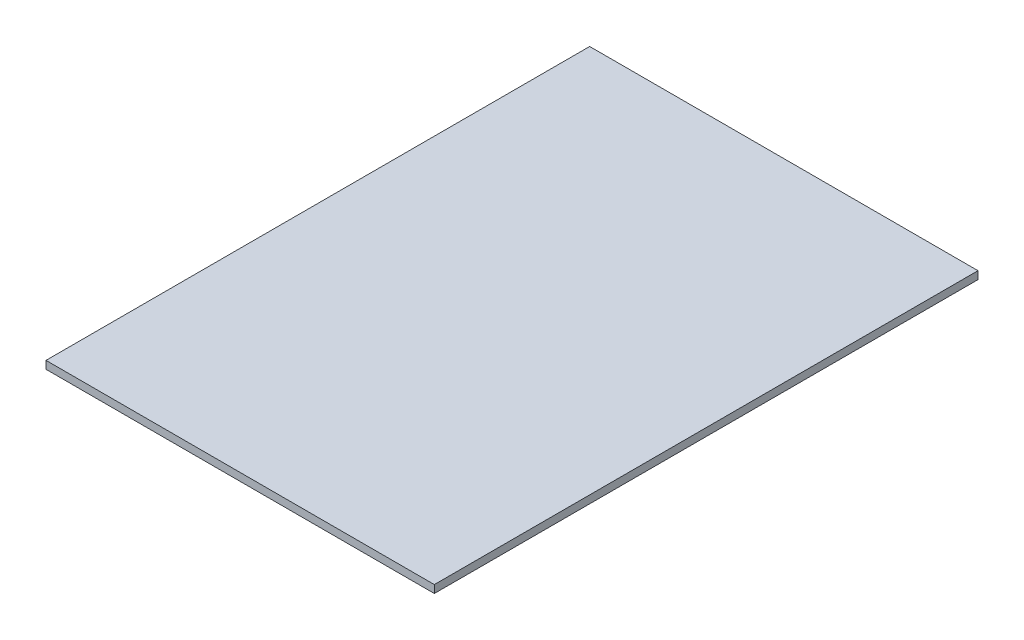
from build123d import *

# Parameters (mm, degrees)
ESQUISSE1_W        = 250
ESQUISSE1_H        = 350
BOSS_EXTRU_1_DEPTH = 5


with BuildPart() as part:
    # Esquisse1 → Boss.-Extru.1 (new body)
    with BuildSketch(Plane(origin=(0, 0, 0), x_dir=(1, 0, 0), z_dir=(0, 1, 0))):
        with Locations((125, 175)):
            Rectangle(ESQUISSE1_W, ESQUISSE1_H)
    extrude(amount=BOSS_EXTRU_1_DEPTH)


solid = part.part
